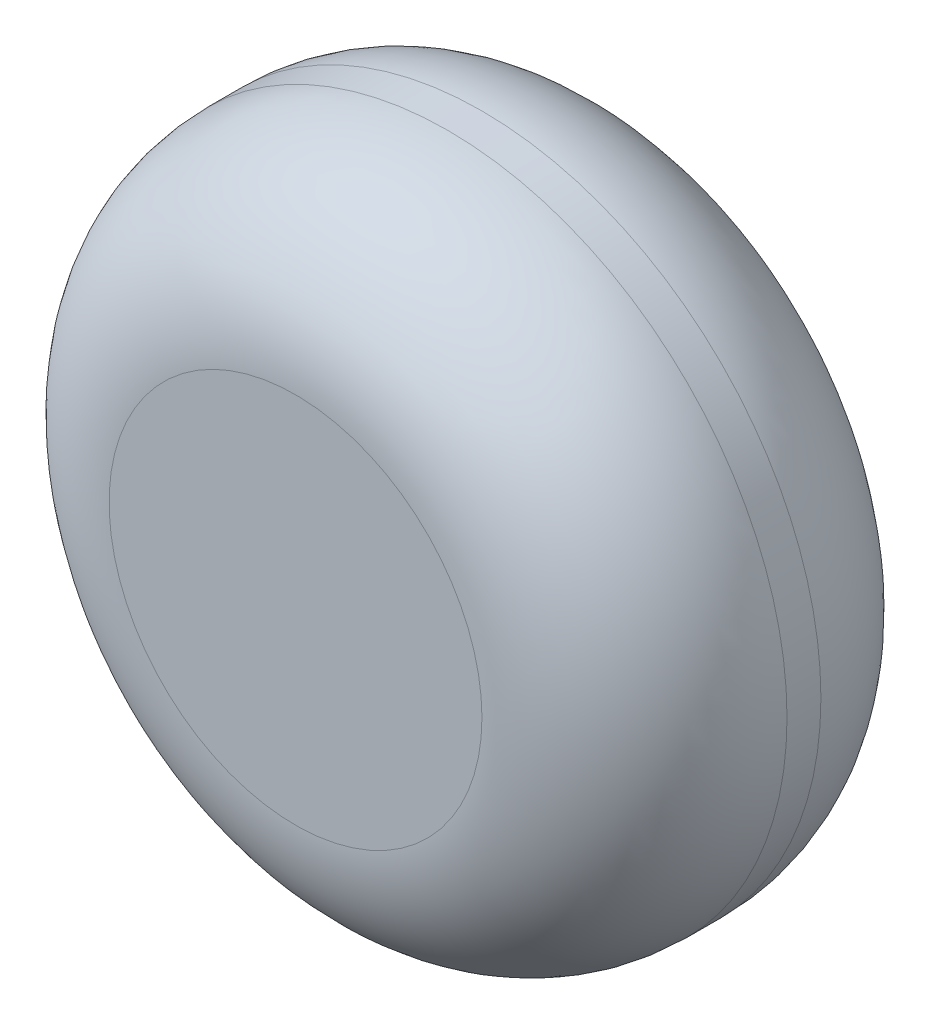
from build123d import *

# Parameters (mm, degrees)
SKETCH1_R           = 100
BOSS_EXTRUDE1_DEPTH = 50
FILLET1_R           = 45


with BuildPart() as part:
    # Sketch1 → Boss-Extrude1 (new, symmetric)
    with BuildSketch(Plane.XY):
        Circle(SKETCH1_R)
    extrude(amount=BOSS_EXTRUDE1_DEPTH, both=True)

    # Fillet1
    fillet1_edges = [part.edges().sort_by_distance(p)[0] for p in [
        (-100, 0, -50),
        (-100, 0, 50),
    ]]
    fillet(fillet1_edges, radius=FILLET1_R)


solid = part.part
